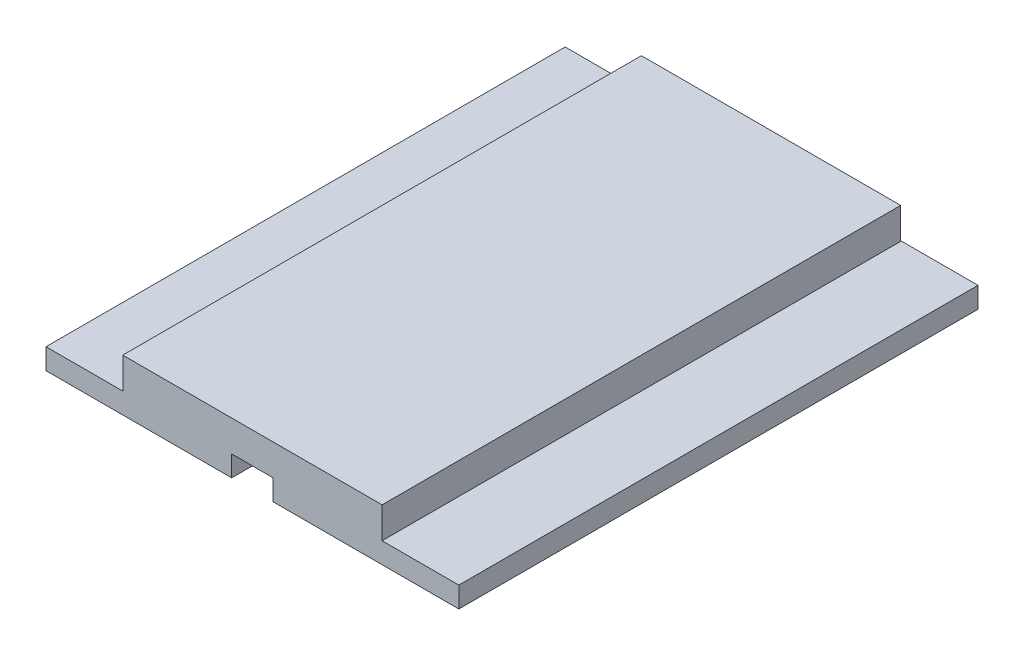
from build123d import *

# Parameters (mm, degrees)
SKETCH1_W           = 5
SKETCH1_H           = 10
BOSS_EXTRUDE1_DEPTH = 0.6
SKETCH2_W           = 3.6
SKETCH2_H           = 10.01049857
BOSS_EXTRUDE2_DEPTH = 0.4
SKETCH4_W           = 10.01049857
SKETCH4_H           = 0.4
CUT_EXTRUDE2_DEPTH  = 0.02
SKETCH5_W           = 10.01049857
SKETCH5_H           = 0.4
CUT_EXTRUDE3_DEPTH  = 0.02


with BuildPart() as part:
    # Sketch1 → Boss-Extrude1 (new body)
    with BuildSketch(Plane(origin=(0, 0, 0), x_dir=(1, 0, 0), z_dir=(0, 1, 0))):
        with Locations((0.556994819, 3.847150259)):
            Rectangle(SKETCH1_W, SKETCH1_H)
    extrude(amount=BOSS_EXTRUDE1_DEPTH)

    # Sketch2 → Boss-Extrude2 (add)
    with BuildSketch(Plane.XZ):
        with Locations((2.756994819, -3.852399544)):
            Rectangle(SKETCH2_W, SKETCH2_H)
        with Locations((-1.643005181, -3.852399544)):
            Rectangle(SKETCH2_W, SKETCH2_H)
    extrude(amount=BOSS_EXTRUDE2_DEPTH)

    # Sketch4 → Cut-Extrude2 (cut)
    with BuildSketch(Plane(origin=(4.556994819, 0, 0), x_dir=(0, 0, -1), z_dir=(1, 0, 0))):
        with Locations((3.852399544, -0.2)):
            Rectangle(SKETCH4_W, SKETCH4_H)
    extrude(amount=-CUT_EXTRUDE2_DEPTH, mode=Mode.SUBTRACT)

    # Sketch5 → Cut-Extrude3 (cut)
    with BuildSketch(Plane.ZY.offset(3.443005181)):
        with Locations((-3.852399544, -0.2)):
            Rectangle(SKETCH5_W, SKETCH5_H)
    extrude(amount=-CUT_EXTRUDE3_DEPTH, mode=Mode.SUBTRACT)


solid = part.part
